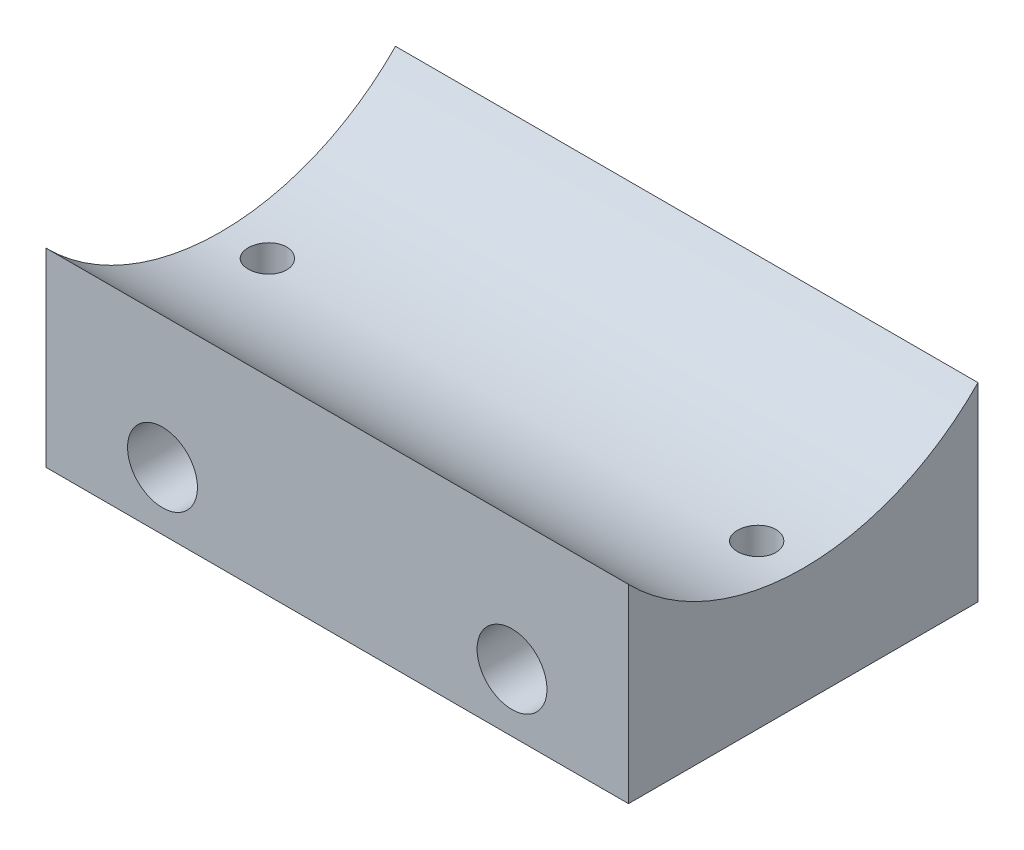
from build123d import *

# Parameters (mm, degrees)
EXTRUDE_1_DEPTH       = 25
HOLE_WIZARD_6_0_6_1_D = 6
HOLE_WIZARD_M4_1_D    = 3.3


with BuildPart() as part:
    # 草图1 → 凸台-拉伸1 (new, symmetric)
    with BuildSketch(Plane(origin=(0, 0, 0), x_dir=(0, 0, -1), z_dir=(1, 0, 0))):
        with BuildLine():
            Line((-15, -31), (15, -31))
            Line((15, -31), (15, -14.696938457))
            ThreePointArc((15, -14.696938457), (0, -21), (-15, -14.696938457))
            Line((-15, -14.696938457), (-15, -31))
        make_face()
    extrude(amount=EXTRUDE_1_DEPTH, both=True)

    # Ø6.0 (6) 直径孔1 (through all)
    with Locations(Plane(origin=(0, 0, -15), x_dir=(-1, 0, 0), z_dir=(0, 0, -1))):
        with Locations((-15, -26), (15, -26)):
            Hole(HOLE_WIZARD_6_0_6_1_D / 2)

    # M4 螺纹孔1 (through all)
    with Locations(Plane(origin=(0, -31, 0), x_dir=(-1, 0, 0), z_dir=(0, -1, 0))):
        with Locations((-21, 0), (21, 0)):
            Hole(HOLE_WIZARD_M4_1_D / 2)


solid = part.part
